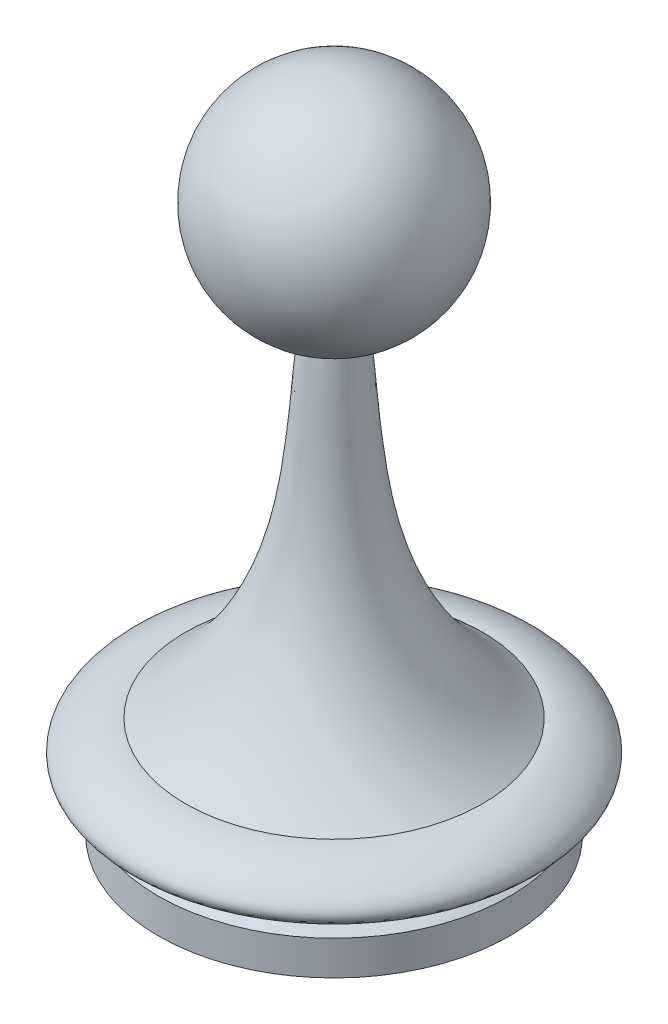
from build123d import *


with BuildPart() as part:
    # Sketch1 → Revolve1 (revolve)
    with BuildSketch(Plane.XY, mode=Mode.PRIVATE) as revolve1_sk:
        with BuildLine():
            Line((0, 0), (0, -1.91))
            Line((0, -1.91), (0.51, -1.91))
            Line((0.51, -1.91), (0.51, -1.81))
            Line((0.51, -1.81), (0.431274074, -1.76))
            add(Edge.make_bspline(
                [(0.431274074, -1.76), (0.73875564, -1.743611087), (0.52212669, -1.607481355), (0.431274074, -1.617032208)],
                knots=[0, 0, 0, 0, 1, 1, 1, 1], degree=3))
            add(Edge.make_bspline(
                [(0.431274074, -1.617032208), (0.29245141, -1.515010547), (0.097752272, -1.190028804), (0.093625058, -0.821372263), (0.073803642, -0.633881308)],
                knots=[0, 0, 0, 0, 0.472390605, 1, 1, 1, 1], degree=3))
            ThreePointArc((0.073803642, -0.633881308), (0.319081686, -0.284086078), (0, 0))
        make_face()
    revolve(revolve1_sk.sketch.rotate(Axis((0, 0, 0), (0, -1, 0)), 90), axis=Axis((0, 0, 0), (0, -1, 0)))


solid = part.part
